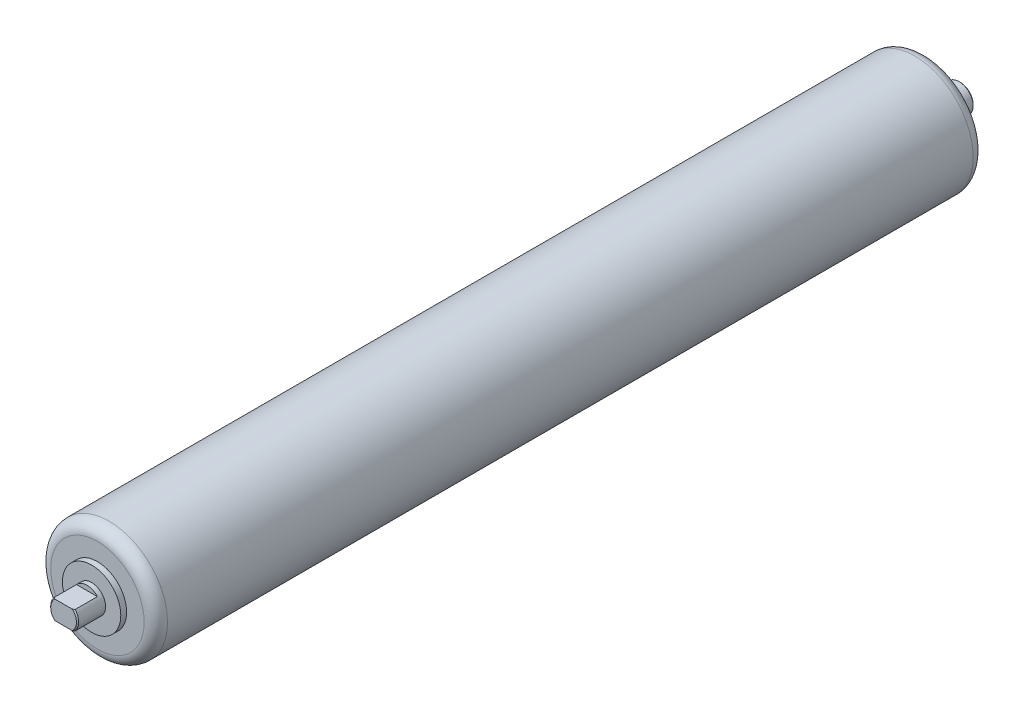
from build123d import *

# Parameters (mm, degrees)
FILLET1_R          = 5
CUT_EXTRUDE1_START = -10
CUT_EXTRUDE1_DEPTH = 10


with BuildPart() as part:
    # Sketch1 → Revolve1 (revolve)
    with BuildSketch(Plane(origin=(0, 0, 0), x_dir=(1, 0, 0), z_dir=(0, 1, 0))):
        Polygon((5.5, 14.5), (0, 14.5), (0, -369.5), (5.5, -369.5), (6, -369), (6, -357.5), (12.5, -357.5), (12.5, -355), (25, -355), (25, 0), (12.5, 0), (12.5, 2.5), (6, 2.5), (6, 14), align=None)
    revolve(axis=Axis((0, 0, -14.5), (0, 0, 1)))

    # Fillet1
    fillet1_edges = [part.edges().sort_by_distance(p)[0] for p in [
        (-25, 0, 355),
        (-25, 0, 0),
    ]]
    fillet(fillet1_edges, radius=FILLET1_R)

    # Sketch2 → Cut-Extrude1 (cut)
    with BuildSketch(Plane.XY.offset(369.5).offset(CUT_EXTRUDE1_START)):
        with BuildLine():
            ThreePointArc((4.472135955, 4), (0, 6), (-4.472135955, 4))
            Line((-4.472135955, 4), (4.472135955, 4))
        make_face()
        with BuildLine():
            Line((4.472135955, -4), (-4.472135955, -4))
            ThreePointArc((-4.472135955, -4), (0, -6), (4.472135955, -4))
        make_face()
    extrude(amount=CUT_EXTRUDE1_DEPTH, mode=Mode.SUBTRACT)


solid = part.part
